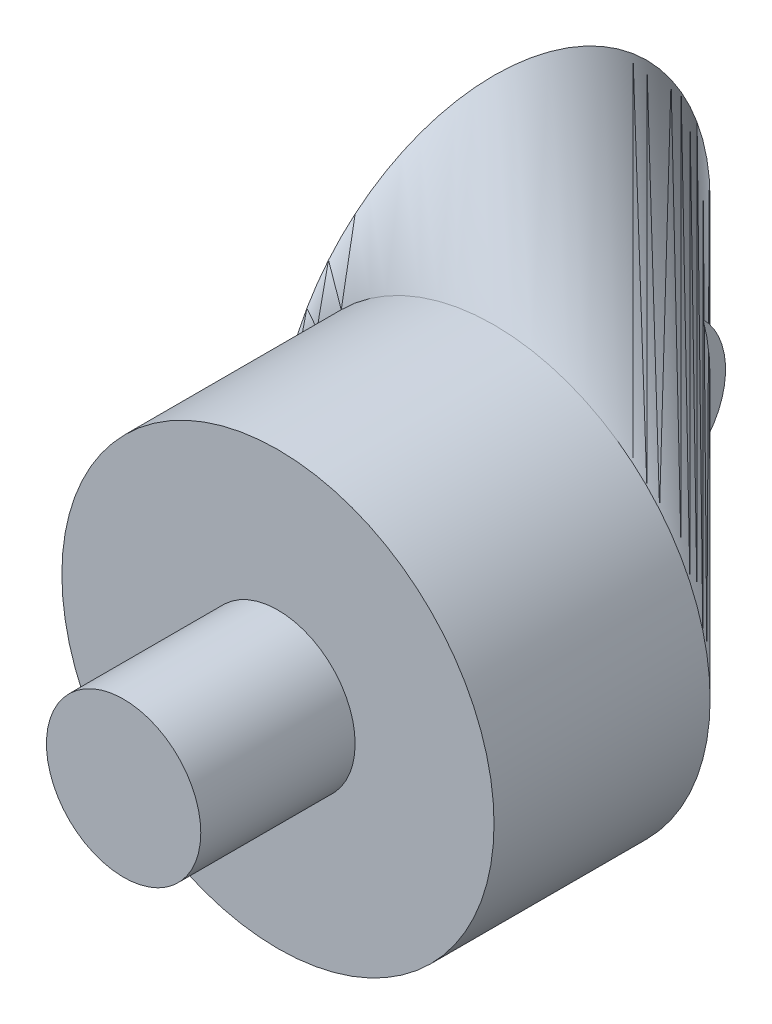
from build123d import *

# Parameters (mm, degrees)
SKETCH1_R           = 70
SKETCH4_R           = 25
CUT_EXTRUDE1_DEPTH  = 50
SKETCH5_R           = 70
BOSS_EXTRUDE2_DEPTH = 70
SKETCH6_R           = 25
BOSS_EXTRUDE3_DEPTH = 50


with BuildPart() as part:
    # Sweep1: sweep along a path in Sketch2
    with BuildLine(Plane(origin=(0, 0, 0), x_dir=(1, 0, 0), z_dir=(0, 1, 0))) as sweep1_path:
        ThreePointArc((70, -70), (49.497474683, -20.502525317), (0, 0))
    # Sketch1 → Sweep1 (sweep)
    with BuildSketch(Plane(origin=(0, 0, 0), x_dir=(0, 0, -1), z_dir=(1, 0, 0))):
        Circle(SKETCH1_R)
    sweep(path=sweep1_path.line)

    # Sketch4 → Cut-Extrude1 (cut)
    with BuildSketch(Plane.ZY):
        Circle(SKETCH4_R)
    extrude(amount=-CUT_EXTRUDE1_DEPTH, mode=Mode.SUBTRACT)

    # Sketch5 → Boss-Extrude2 (add)
    with BuildSketch(Plane.XY.offset(70)):
        with Locations(Location((70, 0, 0), (0, 0, 180))):
            Circle(SKETCH5_R)
    extrude(amount=BOSS_EXTRUDE2_DEPTH)

    # Sketch6 → Boss-Extrude3 (add)
    with BuildSketch(Plane.XY.offset(140)):
        with Locations((70, 0)):
            Circle(SKETCH6_R)
    extrude(amount=BOSS_EXTRUDE3_DEPTH)


solid = part.part
